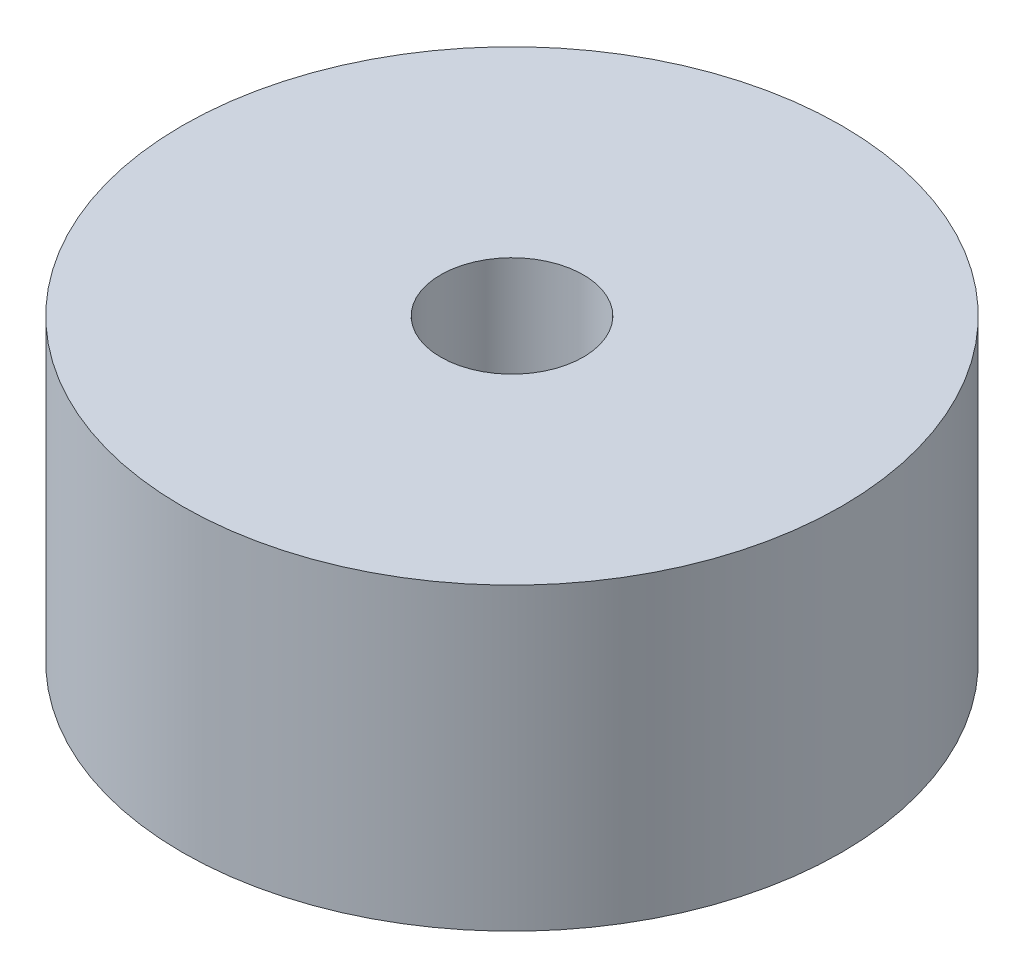
from build123d import *

# Parameters (mm, degrees)
SKETCH1_R           = 5.5
SKETCH1_R_2         = 1.19
BOSS_EXTRUDE1_DEPTH = 5


with BuildPart() as part:
    # Sketch1 → Boss-Extrude1 (new body)
    with BuildSketch(Plane(origin=(0, 0, 0), x_dir=(1, 0, 0), z_dir=(0, 1, 0))):
        with Locations(Location((0, 0, 0), (0, 0, 270))):
            Circle(SKETCH1_R)
        with Locations(Location((0, 0, 0), (0, 0, 270))):
            Circle(SKETCH1_R_2, mode=Mode.SUBTRACT)
    extrude(amount=BOSS_EXTRUDE1_DEPTH)


solid = part.part
